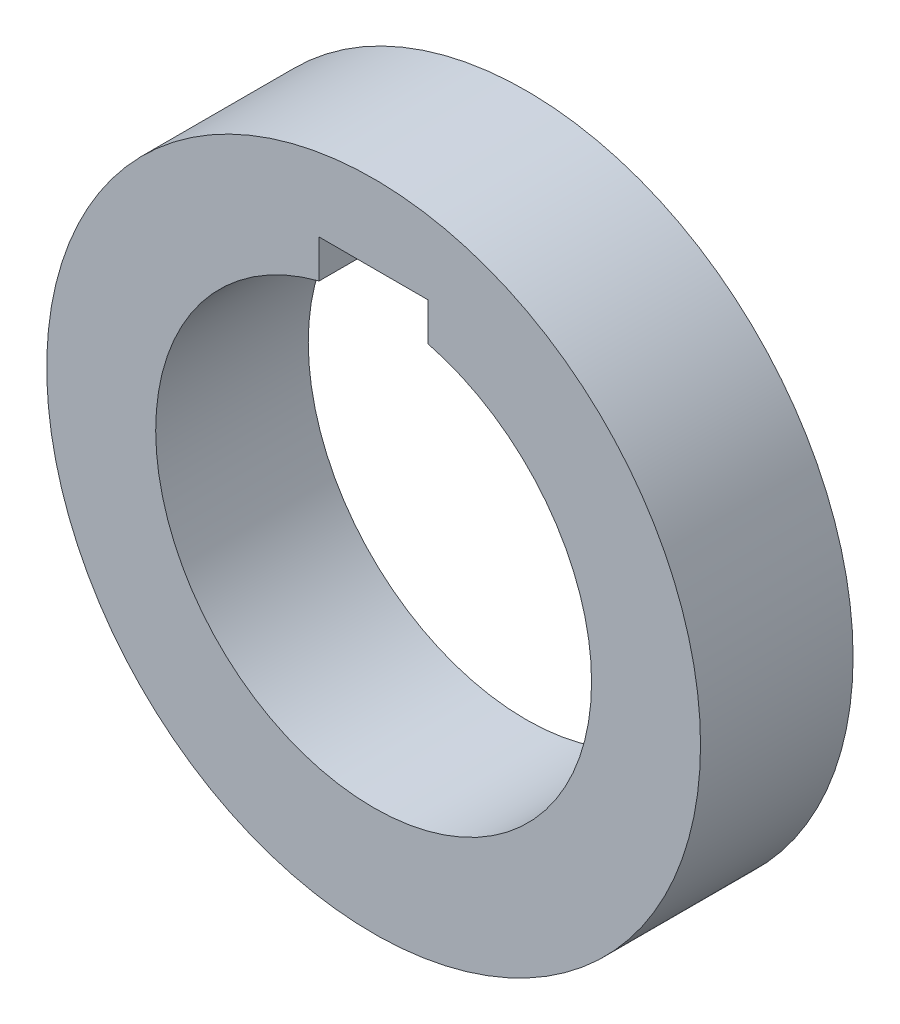
from build123d import *

# Parameters (mm, degrees)
SKETCH1_R           = 15
BOSS_EXTRUDE1_DEPTH = 7


with BuildPart() as part:
    # Sketch1 → Boss-Extrude1 (new body)
    with BuildSketch(Plane.XY):
        Circle(SKETCH1_R)
        with BuildLine():
            Line((-2.5, 9.682458366), (-2.5, 11.43))
            Line((-2.5, 11.43), (2.5, 11.43))
            Line((2.5, 11.43), (2.5, 9.682458366))
            ThreePointArc((2.5, 9.682458366), (0, -10), (-2.5, 9.682458366))
        make_face(mode=Mode.SUBTRACT)
    extrude(amount=BOSS_EXTRUDE1_DEPTH)


solid = part.part
